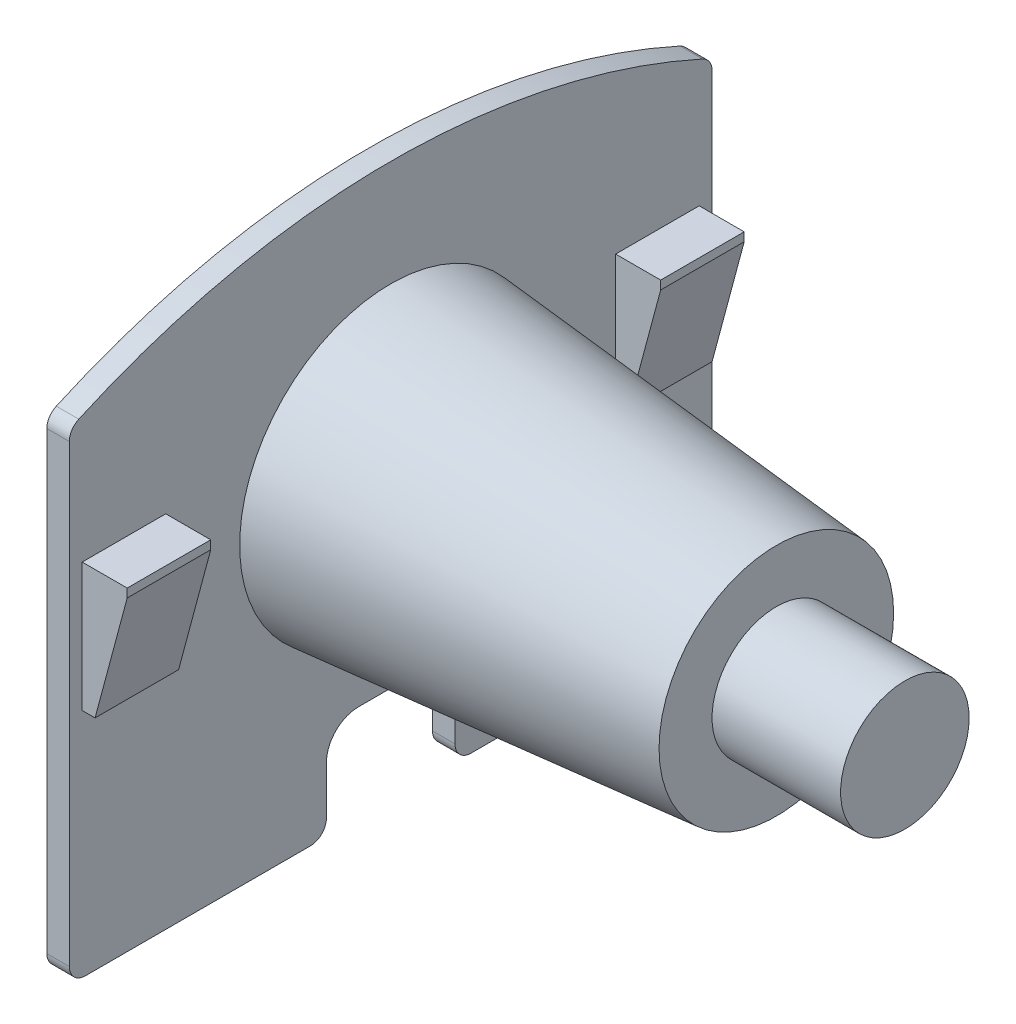
from build123d import *
from OCP.BRepFilletAPI import BRepFilletAPI_MakeChamfer

# Parameters (mm, degrees)
SKETCH1_R           = 2.35
BOSS_EXTRUDE1_DEPTH = 6
BOSS_EXTRUDE1_TAPER = 5
BOSS_EXTRUDE2_DEPTH = 0.35
SKETCH3_W           = 1.3
SKETCH3_H           = 2
BOSS_EXTRUDE3_DEPTH = 0.7
CHAMFER1_SIZE       = 0.5
CHAMFER1_SIZE2      = 1.866025404
FILLET2_R           = 0.5
FILLET3_R           = 0.25
SKETCH4_R           = 1
BOSS_EXTRUDE4_DEPTH = 8


with BuildPart() as part:
    # Sketch1 → Boss-Extrude1 (new body)
    with BuildSketch(Plane(origin=(0, 0, 0), x_dir=(0, 0, -1), z_dir=(1, 0, 0))):
        Circle(SKETCH1_R)
    extrude(amount=BOSS_EXTRUDE1_DEPTH, taper=BOSS_EXTRUDE1_TAPER)

    # Sketch2 → Boss-Extrude2 (add)
    with BuildSketch(Plane(origin=(0, 0, 0), x_dir=(0, 0, -1), z_dir=(1, 0, 0))):
        with BuildLine():
            Line((1, -4.6), (5, -4.6))
            Line((5, -4.6), (5, 2.495381949))
            Line((5, 2.495381949), (5, 2.884339454))
            ThreePointArc((5, 2.884339454), (0, 4), (-5, 2.884339454))
            Line((-5, 2.884339454), (-5, 2.495381949))
            Line((-5, 2.495381949), (-5, -4.6))
            Line((-5, -4.6), (-1, -4.6))
            Line((-1, -4.6), (-1, -3.1))
            Line((-1, -3.1), (1, -3.1))
            Line((1, -3.1), (1, -4.6))
        make_face()
    extrude(amount=-BOSS_EXTRUDE2_DEPTH)

    # Sketch3 → Boss-Extrude3 (add)
    with BuildSketch(Plane(origin=(0, 0, 0), x_dir=(0, 0, -1), z_dir=(1, 0, 0))):
        with Locations((-4.15, 0)):
            Rectangle(SKETCH3_W, SKETCH3_H)
        with Locations((4.15, 0)):
            Rectangle(SKETCH3_W, SKETCH3_H)
    extrude(amount=BOSS_EXTRUDE3_DEPTH)

    # Chamfer1: one chamfer whose edges measure the first distance from different faces: ONE call of the kernel's chamfer builder (chamfer() names one face for all edges)
    chamfer1_edges_1 = [part.edges().sort_by_distance(p)[0] for p in [
        (0.7, -1, 4.15),
    ]]
    chamfer1_side_1 = [part.faces().sort_by_distance(p)[0] for p in [
        (0.35, -1, 4.15),
    ]]
    chamfer1_edges_2 = [part.edges().sort_by_distance(p)[0] for p in [
        (0.7, -1, -4.15),
    ]]
    chamfer1_side_2 = [part.faces().sort_by_distance(p)[0] for p in [
        (0.35, -1, -4.15),
    ]]
    chamfer1 = BRepFilletAPI_MakeChamfer(part.part.solid().wrapped)
    for e in chamfer1_edges_1:
        chamfer1.Add(CHAMFER1_SIZE, CHAMFER1_SIZE2, e.wrapped, chamfer1_side_1[0].wrapped)  # the first distance lies on this face
    for e in chamfer1_edges_2:
        chamfer1.Add(CHAMFER1_SIZE, CHAMFER1_SIZE2, e.wrapped, chamfer1_side_2[0].wrapped)  # the first distance lies on this face
    add(Compound.cast(chamfer1.Shape()), mode=Mode.REPLACE)

    # Fillet2
    fillet2_edges = [part.edges().sort_by_distance(p)[0] for p in [
        (-0.175, -3.1, -1),
        (-0.175, -3.1, 1),
    ]]
    fillet(fillet2_edges, radius=FILLET2_R)

    # Fillet3
    fillet3_edges = [part.edges().sort_by_distance(p)[0] for p in [
        (-0.175, -4.6, 1),
        (-0.175, -4.6, 5),
        (-0.175, 2.884339454, 5),
        (-0.175, 2.884339454, -5),
        (-0.175, -4.6, -5),
        (-0.175, -4.6, -1),
    ]]
    fillet(fillet3_edges, radius=FILLET3_R)

    # Sketch4 → Boss-Extrude4 (add)
    with BuildSketch(Plane(origin=(0, 0, 0), x_dir=(0, 0, -1), z_dir=(1, 0, 0))):
        Circle(SKETCH4_R)
    extrude(amount=BOSS_EXTRUDE4_DEPTH)


solid = part.part
